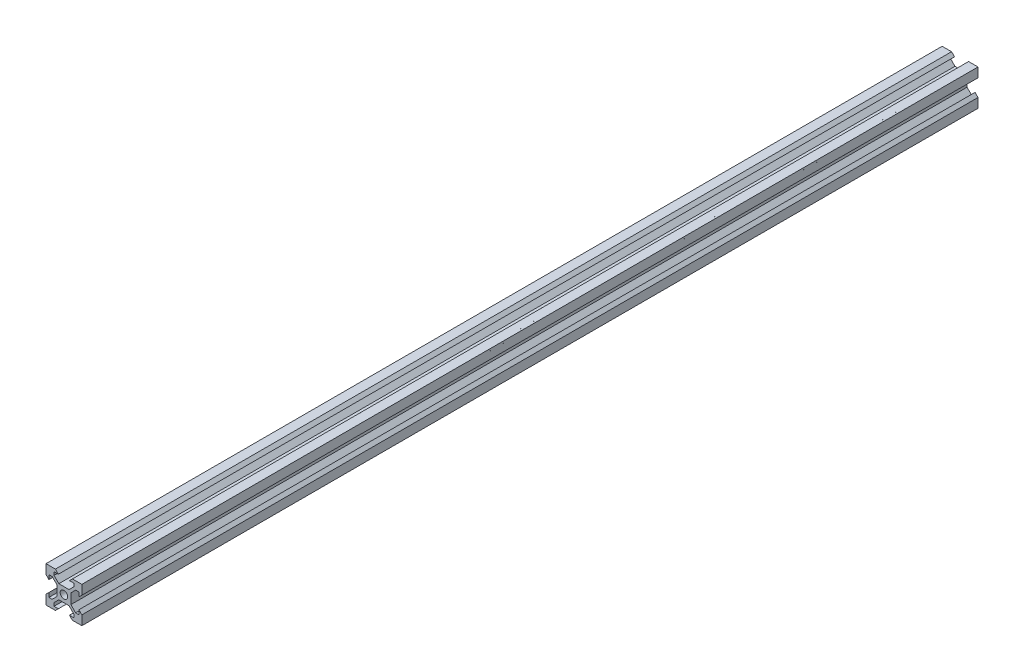
from build123d import *

# Parameters (mm, degrees)
SKETCH1_R           = 2.1
BOSS_EXTRUDE1_DEPTH = 500


with BuildPart() as part:
    # Sketch1 → Boss-Extrude1 (new body)
    with BuildSketch(Plane.XY):
        Polygon((2.834320347, 3.893970342), (5.5, 6.558849663), (5.5, 8.349069506), (3.1, 8.349069506), (4.75, 9.998574117), (10, 9.998574117), (10, 4.746997406), (8.35, 3.097492795), (8.350720674, 5.497492687), (6.560500912, 5.498030255), (3.894821259, 2.833150935), (3.894821259, -2.833150935), (6.560500912, -5.498030255), (8.350720674, -5.497492687), (8.35, -3.097492795), (10, -4.746997406), (10, -9.998574117), (4.75, -9.998574117), (3.1, -8.349069506), (5.5, -8.349069506), (5.5, -6.558849663), (2.834320347, -3.893970342), (-2.834320347, -3.893970342), (-5.5, -6.558849663), (-5.5, -8.349069506), (-3.1, -8.349069506), (-4.75, -9.998574117), (-10, -9.998574117), (-10, -4.746997406), (-8.35, -3.097492795), (-8.350720674, -5.497492687), (-6.560500912, -5.498030255), (-3.894821259, -2.833150935), (-3.894821259, 2.833150935), (-6.560500912, 5.498030255), (-8.350720674, 5.497492687), (-8.35, 3.097492795), (-10, 4.746997406), (-10, 9.998574117), (-4.75, 9.998574117), (-3.1, 8.349069506), (-5.5, 8.349069506), (-5.5, 6.558849663), (-2.834320347, 3.893970342), align=None)
        Circle(SKETCH1_R, mode=Mode.SUBTRACT)
    extrude(amount=BOSS_EXTRUDE1_DEPTH)


solid = part.part
